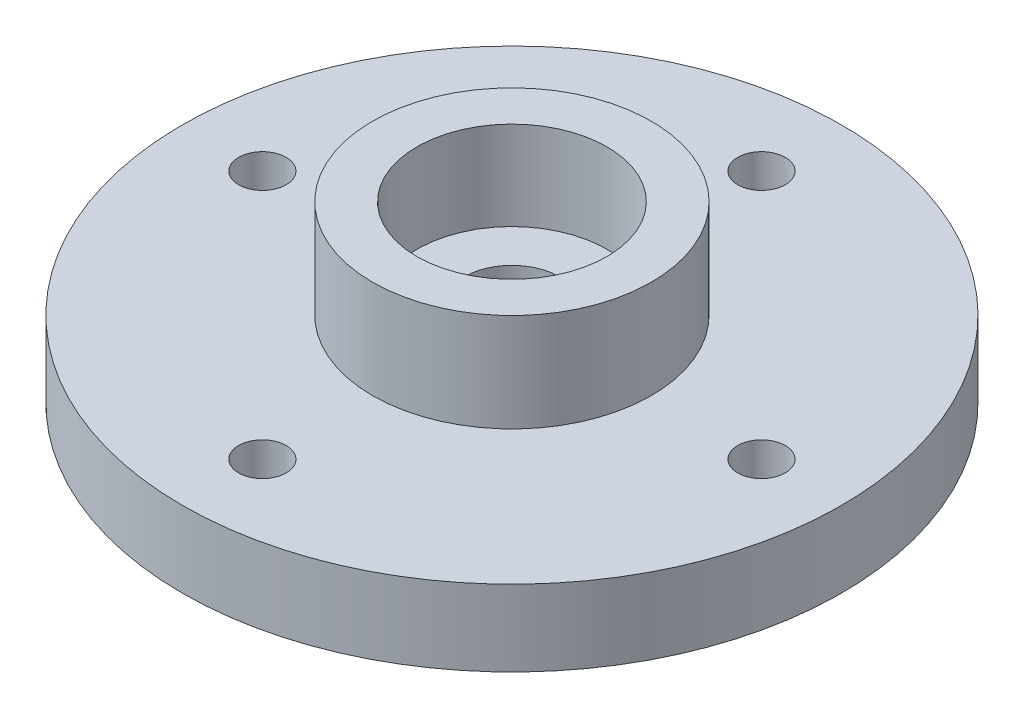
from build123d import *

# Parameters (mm, degrees)
CROQUIS1_R              = 10.4
SALIENTE_EXTRUIR1_DEPTH = 2.4
SALIENTE_EXTRUIR2_START = -2.4
CROQUIS2_R              = 4.4
SALIENTE_EXTRUIR2_DEPTH = 5.5
CROQUIS3_R              = 3
CORTAR_EXTRUIR1_DEPTH   = 2.8
CROQUIS4_R              = 0.75
CORTAR_EXTRUIR2_DEPTH   = 16.030968033
CROQUIS5_R              = 1.5
CORTAR_EXTRUIR3_DEPTH   = 15.971973818


with BuildPart() as part:
    # Croquis1 → Saliente-Extruir1 (new body)
    with BuildSketch(Plane(origin=(0, 0, 0), x_dir=(1, 0, 0), z_dir=(0, 1, 0))):
        with Locations(Location((0, 0, 0), (0, 0, 270))):
            Circle(CROQUIS1_R)
    extrude(amount=SALIENTE_EXTRUIR1_DEPTH)

    # Croquis2 → Saliente-Extruir2 (add)
    with BuildSketch(Plane(origin=(0, 2.4, 0), x_dir=(1, 0, 0), z_dir=(0, 1, 0)).offset(SALIENTE_EXTRUIR2_START)):
        with Locations(Location((0, 0, 0), (0, 0, 270))):
            Circle(CROQUIS2_R)
    extrude(amount=SALIENTE_EXTRUIR2_DEPTH)

    # Croquis3 → Cortar-Extruir1 (cut)
    with BuildSketch(Plane(origin=(0, 5.5, 0), x_dir=(1, 0, 0), z_dir=(0, 1, 0))):
        with Locations(Location((0, 0, 0), (0, 0, 270))):
            Circle(CROQUIS3_R)
    extrude(amount=-CORTAR_EXTRUIR1_DEPTH, mode=Mode.SUBTRACT)

    # Croquis4 → Cortar-Extruir2 (cut, through all)
    with BuildSketch(Plane(origin=(0, 2.4, 0), x_dir=(1, 0, 0), z_dir=(0, 1, 0))):
        with Locations(Location((0, 7.875, 0), (0, 0, 270))):
            Circle(CROQUIS4_R)
        with Locations(Location((7.875, 0, 0), (0, 0, 270))):
            Circle(CROQUIS4_R)
        with Locations(Location((0, -7.875, 0), (0, 0, 270))):
            Circle(CROQUIS4_R)
        with Locations(Location((-7.875, 0, 0), (0, 0, 270))):
            Circle(CROQUIS4_R)
    extrude(amount=-CORTAR_EXTRUIR2_DEPTH, mode=Mode.SUBTRACT)

    # Croquis5 → Cortar-Extruir3 (cut, through all)
    with BuildSketch(Plane(origin=(0, 2.7, 0), x_dir=(1, 0, 0), z_dir=(0, 1, 0))):
        with Locations(Location((0, 0, 0), (0, 0, 270))):
            Circle(CROQUIS5_R)
    extrude(amount=-CORTAR_EXTRUIR3_DEPTH, mode=Mode.SUBTRACT)


solid = part.part
